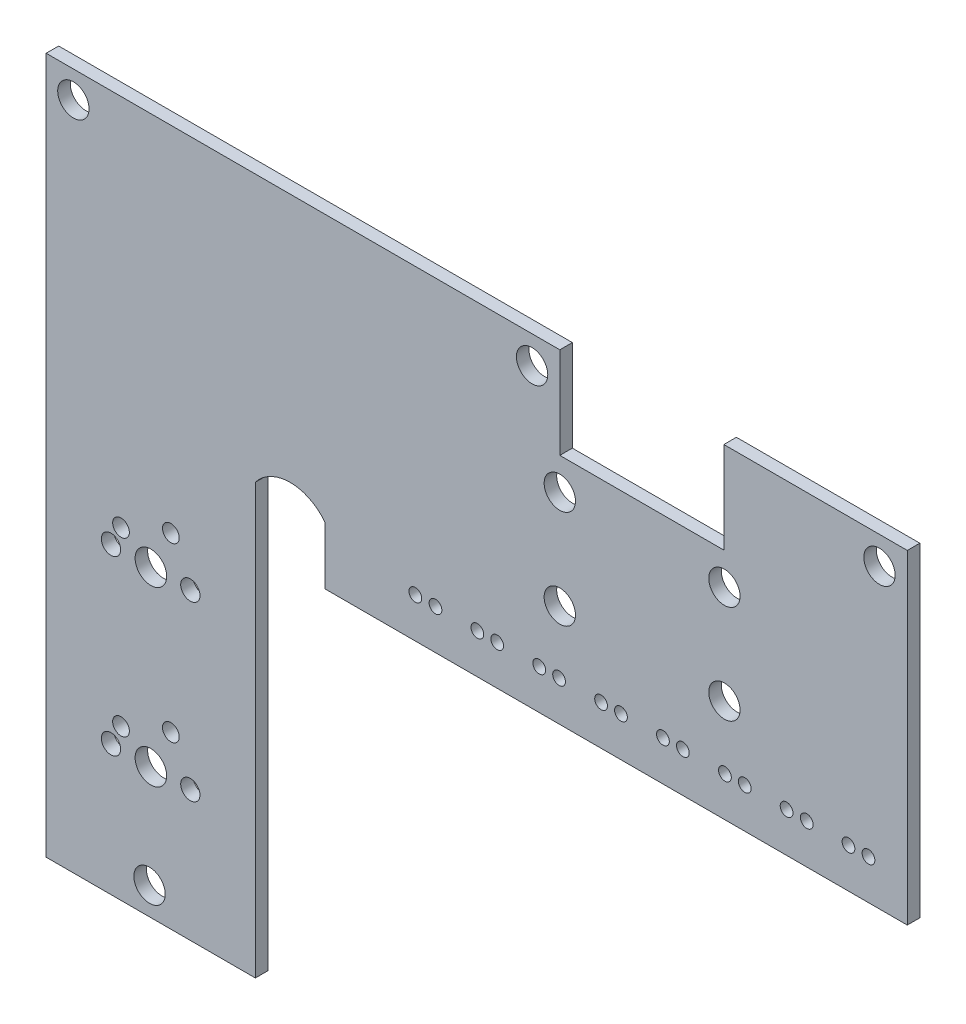
from build123d import *

# Parameters (mm, degrees)
SKETCH1_R           = 2
SKETCH1_R_2         = 1.230505914
SKETCH1_R_3         = 1.065619784
SKETCH1_R_4         = 2.013222478
SKETCH1_R_5         = 0.813520941
BOSS_EXTRUDE1_DEPTH = 1.6


with BuildPart() as part:
    # Sketch1 → Boss-Extrude1 (new body)
    with BuildSketch(Plane.XY):
        with BuildLine():
            Line((-43.390980767, 89.104719312), (-43.390980767, 0.289327535))
            Line((-43.390980767, 0.289327535), (-16.705853066, 0.289327535))
            Line((-16.705853066, 0.289327535), (-16.705853066, 55.060343389))
            ThreePointArc((-16.705853066, 55.060343389), (-12.260853066, 57.261941316), (-7.815853066, 55.060343389))
            Line((-7.815853066, 55.060343389), (-7.815853066, 47.714452921))
            Line((-7.815853066, 47.714452921), (66.454194778, 47.714452921))
            Line((66.454194778, 47.714452921), (66.454194778, 48.476452921))
            Line((66.454194778, 48.476452921), (66.454194778, 89.104719312))
            Line((66.454194778, 89.104719312), (43.055141469, 89.104719312))
            Line((43.055141469, 89.104719312), (43.055141469, 77.440236178))
            Line((43.055141469, 77.440236178), (22.130034422, 77.440236178))
            Line((22.130034422, 77.440236178), (22.130034422, 89.104719312))
            Line((22.130034422, 89.104719312), (-43.390980767, 89.104719312))
        make_face()
        with Locations((-30.204884299, 3.786024021)):
            Circle(SKETCH1_R, mode=Mode.SUBTRACT)
        with Locations((-35.12092244, 16.959583239)):
            Circle(SKETCH1_R_2, mode=Mode.SUBTRACT)
        with Locations((-33.844684508, 19.525695646)):
            Circle(SKETCH1_R_3, mode=Mode.SUBTRACT)
        with Locations((-30.03593296, 16.959583239)):
            Circle(SKETCH1_R_4, mode=Mode.SUBTRACT)
        with Locations((-25.002523415, 16.959583239)):
            Circle(SKETCH1_R_2, mode=Mode.SUBTRACT)
        with Locations((-27.486377969, 22.058201664)):
            Circle(SKETCH1_R_3, mode=Mode.SUBTRACT)
        with Locations((-35.12092244, 38.997647894)):
            Circle(SKETCH1_R_2, mode=Mode.SUBTRACT)
        with Locations((-30.03593296, 38.997647894)):
            Circle(SKETCH1_R_4, mode=Mode.SUBTRACT)
        with Locations((-33.844684508, 41.478225078)):
            Circle(SKETCH1_R_3, mode=Mode.SUBTRACT)
        with Locations((-25.002523415, 38.997647894)):
            Circle(SKETCH1_R_2, mode=Mode.SUBTRACT)
        with Locations((-27.486377969, 44.045488268)):
            Circle(SKETCH1_R_3, mode=Mode.SUBTRACT)
        with Locations((3.702023102, 52.815358714)):
            Circle(SKETCH1_R_5, mode=Mode.SUBTRACT)
        with Locations((6.270118325, 52.815358714)):
            Circle(SKETCH1_R_5, mode=Mode.SUBTRACT)
        with Locations((-39.919519396, 85.68551268)):
            Circle(SKETCH1_R, mode=Mode.SUBTRACT)
        with Locations((11.611877913, 52.793786064)):
            Circle(SKETCH1_R_5, mode=Mode.SUBTRACT)
        with Locations((14.144190439, 52.793786064)):
            Circle(SKETCH1_R_5, mode=Mode.SUBTRACT)
        with Locations((19.502215653, 52.793786064)):
            Circle(SKETCH1_R_5, mode=Mode.SUBTRACT)
        with Locations((22.036775121, 52.793786064)):
            Circle(SKETCH1_R_5, mode=Mode.SUBTRACT)
        with Locations((27.392356576, 52.793786064)):
            Circle(SKETCH1_R_5, mode=Mode.SUBTRACT)
        with Locations((29.931743714, 52.793786064)):
            Circle(SKETCH1_R_5, mode=Mode.SUBTRACT)
        with Locations((35.282808648, 52.828198648)):
            Circle(SKETCH1_R_5, mode=Mode.SUBTRACT)
        with Locations((37.828059634, 52.828198648)):
            Circle(SKETCH1_R_5, mode=Mode.SUBTRACT)
        with Locations((22.130034422, 60.797517772)):
            Circle(SKETCH1_R, mode=Mode.SUBTRACT)
        with Locations((43.190352962, 52.793786064)):
            Circle(SKETCH1_R_5, mode=Mode.SUBTRACT)
        with Locations((45.720365379, 52.828198648)):
            Circle(SKETCH1_R_5, mode=Mode.SUBTRACT)
        with Locations((51.055737978, 52.793786064)):
            Circle(SKETCH1_R_5, mode=Mode.SUBTRACT)
        with Locations((53.630473203, 52.793786064)):
            Circle(SKETCH1_R_5, mode=Mode.SUBTRACT)
        with Locations((58.949894198, 52.793786064)):
            Circle(SKETCH1_R_5, mode=Mode.SUBTRACT)
        with Locations((61.501156091, 52.793786064)):
            Circle(SKETCH1_R_5, mode=Mode.SUBTRACT)
        with Locations((43.125719502, 60.797517772)):
            Circle(SKETCH1_R, mode=Mode.SUBTRACT)
        with Locations((22.130034422, 73.370517772)):
            Circle(SKETCH1_R, mode=Mode.SUBTRACT)
        with Locations((18.59384388, 85.577256227)):
            Circle(SKETCH1_R, mode=Mode.SUBTRACT)
        with Locations((43.125719502, 73.370517772)):
            Circle(SKETCH1_R, mode=Mode.SUBTRACT)
        with Locations((62.904421424, 85.577256227)):
            Circle(SKETCH1_R, mode=Mode.SUBTRACT)
    extrude(amount=BOSS_EXTRUDE1_DEPTH)


solid = part.part
